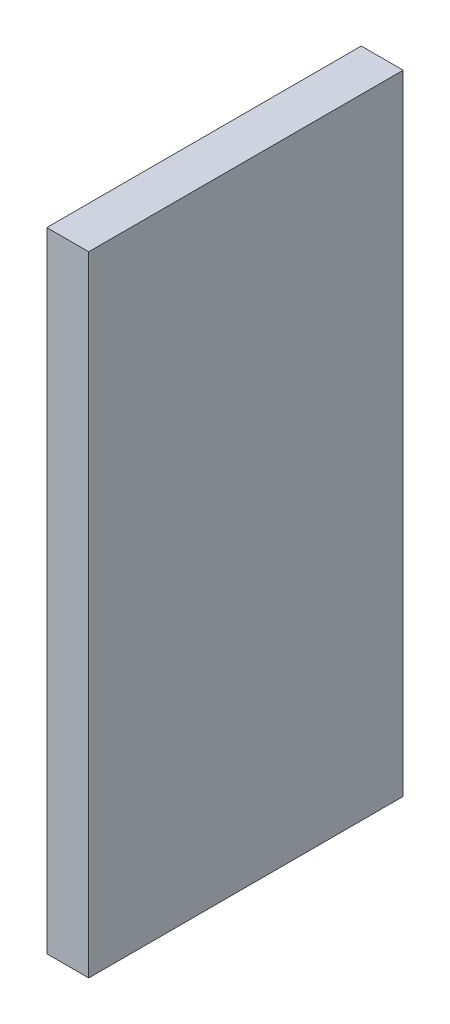
from build123d import *

# Parameters (mm, degrees)
SKETCH1_W           = 4
SKETCH1_H           = 30
BOSS_EXTRUDE1_DEPTH = 60


with BuildPart() as part:
    # Sketch1 → Boss-Extrude1 (new body)
    with BuildSketch(Plane(origin=(0, 0, 0), x_dir=(1, 0, 0), z_dir=(0, 1, 0))):
        with Locations((2, 15)):
            Rectangle(SKETCH1_W, SKETCH1_H)
    extrude(amount=BOSS_EXTRUDE1_DEPTH)


solid = part.part
